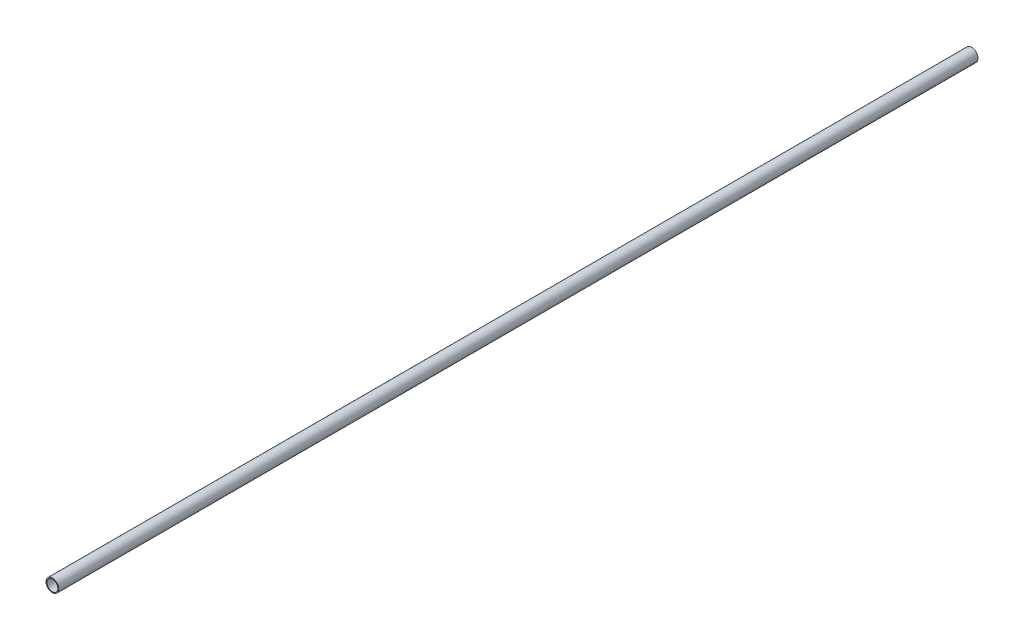
from build123d import *

# Parameters (mm, degrees)
BOSS_EXTRUDE1_DEPTH      = 457.2
BOSS_EXTRUDE1_DEPTH_BACK = 457.2
SKETCH1_R                = 6.35
SKETCH1_R_2              = 5.461


with BuildPart() as part:
    # Sketch1 → Boss-Extrude1 (new, two sides: drawn at the far end of the back side and taken through both)
    with BuildSketch(Plane.XY.offset(-BOSS_EXTRUDE1_DEPTH_BACK)):
        Circle(SKETCH1_R)
        Circle(SKETCH1_R_2, mode=Mode.SUBTRACT)
    extrude(amount=BOSS_EXTRUDE1_DEPTH + BOSS_EXTRUDE1_DEPTH_BACK)


solid = part.part
